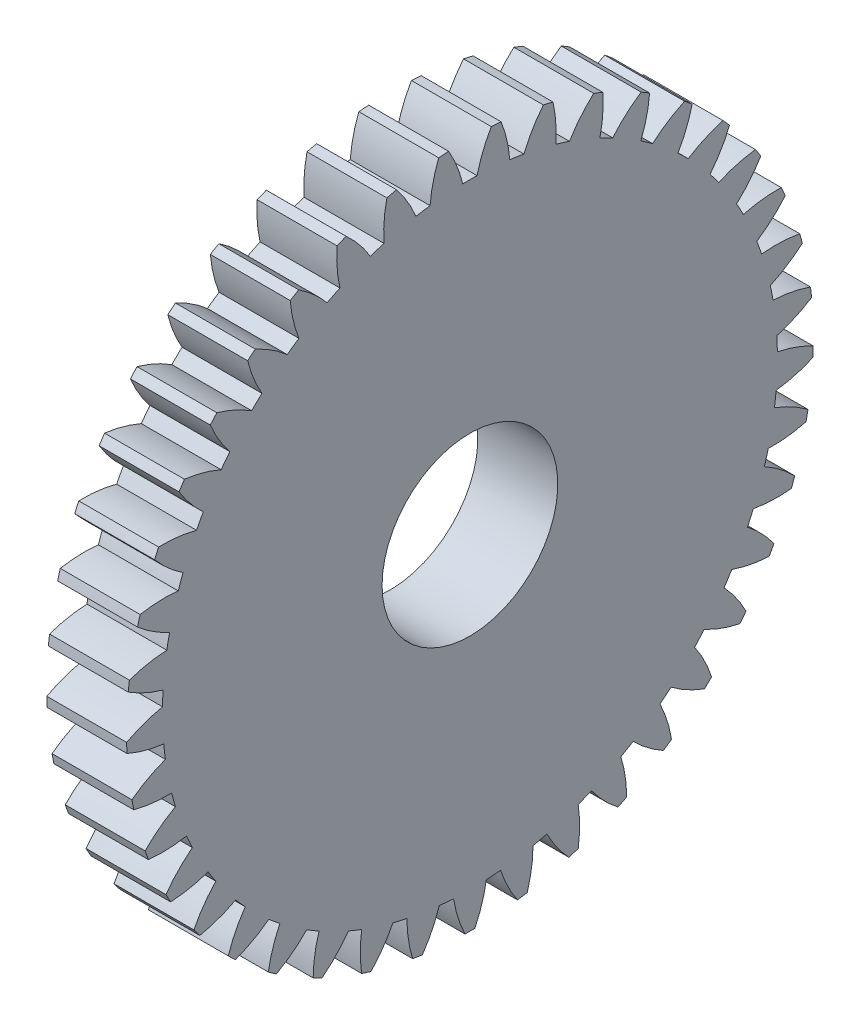
from build123d import *

# Parameters (mm, degrees)
SKETCH1_R           = 5.5
BOSS_EXTRUDE1_DEPTH = 2.5


with BuildPart() as part:
    # Sketch1 → Boss-Extrude1 (new, symmetric)
    with BuildSketch(Plane(origin=(0, 0, 0), x_dir=(0, 0, -1), z_dir=(1, 0, 0))):
        with BuildLine():
            ThreePointArc((-21.391404293, 2.158198868), (-20.337604136, 1.591457152), (-19.212545081, 1.184108323))
            ThreePointArc((-19.212545081, 1.184108323), (-19.234874719, 0.737289321), (-19.246814261, 0.290072057))
            ThreePointArc((-19.246814261, 0.290072057), (-20.399754417, -0.029959099), (-21.493846171, -0.514370267))
            ThreePointArc((-21.493846171, -0.514370267), (-21.484222893, -0.823508774), (-21.470153613, -1.132476862))
            ThreePointArc((-21.470153613, -1.132476862), (-20.342190829, -1.531714765), (-19.168135482, -1.762550179))
            ThreePointArc((-19.168135482, -1.762550179), (-19.121996826, -2.207541255), (-19.065529046, -2.651339885))
            ThreePointArc((-19.065529046, -2.651339885), (-20.156104706, -3.143615901), (-21.16342915, -3.789362299))
            ThreePointArc((-21.16342915, -3.789362299), (-21.10672888, -4.093408847), (-21.045660729, -4.396608295))
            ThreePointArc((-21.045660729, -4.396608295), (-19.86997381, -4.618984587), (-18.674441034, -4.667895999))
            ThreePointArc((-18.674441034, -4.667895999), (-18.560915534, -5.100628936), (-18.43736399, -5.530606667))
            ThreePointArc((-18.43736399, -5.530606667), (-19.440012983, -6.183589011), (-20.336959286, -6.97553489))
            ThreePointArc((-20.336959286, -6.97553489), (-20.234511032, -7.267362886), (-20.127875394, -7.557686955))
            ThreePointArc((-20.127875394, -7.557686955), (-18.932021447, -7.597989325), (-17.743033516, -7.463830293))
            ThreePointArc((-17.743033516, -7.463830293), (-17.564782114, -7.874162197), (-17.377042748, -8.280240717))
            ThreePointArc((-17.377042748, -8.280240717), (-18.268263833, -9.078624036), (-19.033808334, -9.998206855))
            ThreePointArc((-19.033808334, -9.998206855), (-18.888013395, -10.270976098), (-18.738309721, -10.541619838))
            ThreePointArc((-18.738309721, -10.541619838), (-17.550318547, -10.398903632), (-16.395744331, -10.084818731))
            ThreePointArc((-16.395744331, -10.084818731), (-16.156945088, -10.46313177), (-15.909418353, -10.835792942))
            ThreePointArc((-15.909418353, -10.835792942), (-16.668322062, -11.760863807), (-17.284521046, -12.786529326))
            ThreePointArc((-17.284521046, -12.786529326), (-17.098796732, -13.033846336), (-16.909533949, -13.278466087))
            ThreePointArc((-16.909533949, -13.278466087), (-15.757251055, -12.956076452), (-14.664152794, -12.469427566))
            ThreePointArc((-14.664152794, -12.469427566), (-14.370402963, -12.806854402), (-14.068890675, -13.137363365))
            ThreePointArc((-14.068890675, -13.137363365), (-14.677688949, -14.167438899), (-15.130099235, -15.275146387))
            ThreePointArc((-15.130099235, -15.275146387), (-14.908798767, -15.491214262), (-14.684413033, -15.704076346))
            ThreePointArc((-14.684413033, -15.704076346), (-13.594846953, -15.209569822), (-12.588845946, -14.561763587))
            ThreePointArc((-12.588845946, -14.561763587), (-12.247030772, -14.850395222), (-11.898600124, -15.131005125))
            ThreePointArc((-11.898600124, -15.131005125), (-12.343023247, -16.241941231), (-12.621040722, -17.405726963))
            ThreePointArc((-12.621040722, -17.405726963), (-12.369351195, -17.585481256), (-12.115101922, -17.761596365))
            ThreePointArc((-12.115101922, -17.761596365), (-11.113791161, -17.106563765), (-10.218467217, -16.312784211))
            ThreePointArc((-10.218467217, -16.312784211), (-9.836598561, -16.545855365), (-9.449416472, -16.769988949))
            ThreePointArc((-9.449416472, -16.769988949), (-9.719047542, -17.935746227), (-9.816155711, -19.128332051))
            ThreePointArc((-9.816155711, -19.128332051), (-9.539976514, -19.267559475), (-9.26182309, -19.402799619))
            ThreePointArc((-9.26182309, -19.402799619), (-8.372237525, -18.602594353), (-7.608576279, -17.681447))
            ThreePointArc((-7.608576279, -17.681447), (-7.195604816, -17.853494681), (-6.778746506, -18.015898446))
            ThreePointArc((-6.778746506, -18.015898446), (-6.8672656, -19.209152532), (-6.78118833, -20.402585249))
            ThreePointArc((-6.78118833, -20.402585249), (-6.48699287, -20.498022429), (-6.191454975, -20.589217695))
            ThreePointArc((-6.191454975, -20.589217695), (-5.434445736, -19.662595896), (-4.82034676, -18.635671657))
            ThreePointArc((-4.82034676, -18.635671657), (-4.385952193, -18.742663214), (-3.949188467, -18.839530553))
            ThreePointArc((-3.949188467, -18.839530553), (-3.854520773, -20.032312584), (-3.587275642, -21.198619141))
            ThreePointArc((-3.587275642, -21.198619141), (-3.281959611, -21.248029111), (-2.975964402, -21.293041959))
            ThreePointArc((-2.975964402, -21.293041959), (-2.369275146, -20.261722857), (-1.9191324, -19.153091965))
            ThreePointArc((-1.9191324, -19.153091965), (-1.473496568, -19.192519607), (-1.027064798, -19.221580031))
            ThreePointArc((-1.027064798, -19.221580031), (-0.751429246, -20.385932206), (-0.309280253, -21.497775367))
            ThreePointArc((-0.309280253, -21.497775367), (0, -21.5), (0.309280253, -21.497775367))
            ThreePointArc((0.309280253, -21.497775367), (0.751429246, -20.385932206), (1.027064798, -19.221580031))
            ThreePointArc((1.027064798, -19.221580031), (1.473496568, -19.192519607), (1.9191324, -19.153091965))
            ThreePointArc((1.9191324, -19.153091965), (2.369275146, -20.261722857), (2.975964402, -21.293041959))
            ThreePointArc((2.975964402, -21.293041959), (3.281959611, -21.248029111), (3.587275642, -21.198619141))
            ThreePointArc((3.587275642, -21.198619141), (3.854520773, -20.032312584), (3.949188467, -18.839530553))
            ThreePointArc((3.949188467, -18.839530553), (4.385952193, -18.742663214), (4.82034676, -18.635671657))
            ThreePointArc((4.82034676, -18.635671657), (5.434445736, -19.662595896), (6.191454975, -20.589217695))
            ThreePointArc((6.191454975, -20.589217695), (6.48699287, -20.498022429), (6.78118833, -20.402585249))
            ThreePointArc((6.78118833, -20.402585249), (6.8672656, -19.209152532), (6.778746506, -18.015898446))
            ThreePointArc((6.778746506, -18.015898446), (7.195604816, -17.853494681), (7.608576279, -17.681447))
            ThreePointArc((7.608576279, -17.681447), (8.372237525, -18.602594353), (9.26182309, -19.402799619))
            ThreePointArc((9.26182309, -19.402799619), (9.539976514, -19.267559475), (9.816155711, -19.128332051))
            ThreePointArc((9.816155711, -19.128332051), (9.719047542, -17.935746227), (9.449416472, -16.769988949))
            ThreePointArc((9.449416472, -16.769988949), (9.836598561, -16.545855365), (10.218467217, -16.312784211))
            ThreePointArc((10.218467217, -16.312784211), (11.113791161, -17.106563765), (12.115101922, -17.761596365))
            ThreePointArc((12.115101922, -17.761596365), (12.369351195, -17.585481256), (12.621040722, -17.405726963))
            ThreePointArc((12.621040722, -17.405726963), (12.343023247, -16.241941231), (11.898600124, -15.131005125))
            ThreePointArc((11.898600124, -15.131005125), (12.247030772, -14.850395222), (12.588845946, -14.561763587))
            ThreePointArc((12.588845946, -14.561763587), (13.594846953, -15.209569822), (14.684413033, -15.704076346))
            ThreePointArc((14.684413033, -15.704076346), (14.908798767, -15.491214262), (15.130099235, -15.275146387))
            ThreePointArc((15.130099235, -15.275146387), (14.677688949, -14.167438899), (14.068890675, -13.137363365))
            ThreePointArc((14.068890675, -13.137363365), (14.370402963, -12.806854402), (14.664152794, -12.469427566))
            ThreePointArc((14.664152794, -12.469427566), (15.757251055, -12.956076452), (16.909533949, -13.278466087))
            ThreePointArc((16.909533949, -13.278466087), (17.098796732, -13.033846336), (17.284521046, -12.786529326))
            ThreePointArc((17.284521046, -12.786529326), (16.668322062, -11.760863807), (15.909418353, -10.835792942))
            ThreePointArc((15.909418353, -10.835792942), (16.156945088, -10.46313177), (16.395744331, -10.084818731))
            ThreePointArc((16.395744331, -10.084818731), (17.550318547, -10.398903632), (18.738309721, -10.541619838))
            ThreePointArc((18.738309721, -10.541619838), (18.888013395, -10.270976098), (19.033808334, -9.998206855))
            ThreePointArc((19.033808334, -9.998206855), (18.268263833, -9.078624036), (17.377042748, -8.280240717))
            ThreePointArc((17.377042748, -8.280240717), (17.564782114, -7.874162197), (17.743033516, -7.463830293))
            ThreePointArc((17.743033516, -7.463830293), (18.932021447, -7.597989325), (20.127875394, -7.557686955))
            ThreePointArc((20.127875394, -7.557686955), (20.234511032, -7.267362886), (20.336959286, -6.97553489))
            ThreePointArc((20.336959286, -6.97553489), (19.440012983, -6.183589011), (18.43736399, -5.530606667))
            ThreePointArc((18.43736399, -5.530606667), (18.560915534, -5.100628936), (18.674441034, -4.667895999))
            ThreePointArc((18.674441034, -4.667895999), (19.86997381, -4.618984587), (21.045660729, -4.396608295))
            ThreePointArc((21.045660729, -4.396608295), (21.10672888, -4.093408847), (21.16342915, -3.789362299))
            ThreePointArc((21.16342915, -3.789362299), (20.156104706, -3.143615901), (19.065529046, -2.651339885))
            ThreePointArc((19.065529046, -2.651339885), (19.121996826, -2.207541255), (19.168135482, -1.762550179))
            ThreePointArc((19.168135482, -1.762550179), (20.342190829, -1.531714765), (21.470153613, -1.132476862))
            ThreePointArc((21.470153613, -1.132476862), (21.484222893, -0.823508774), (21.493846171, -0.514370267))
            ThreePointArc((21.493846171, -0.514370267), (20.399754417, -0.029959099), (19.246814261, 0.290072057))
            ThreePointArc((19.246814261, 0.290072057), (19.234874719, 0.737289321), (19.212545081, 1.184108323))
            ThreePointArc((19.212545081, 1.184108323), (20.337604136, 1.591457152), (21.391404293, 2.158198868))
            ThreePointArc((21.391404293, 2.158198868), (21.35814493, 2.465693646), (21.320465656, 2.772678167))
            ThreePointArc((21.320465656, 2.772678167), (20.165251176, 3.084399919), (18.976970463, 3.224684956))
            ThreePointArc((18.976970463, 3.224684956), (18.896903452, 3.66483846), (18.806628906, 4.10301233))
            ThreePointArc((18.806628906, 4.10301233), (19.856321239, 4.677326663), (20.811258588, 5.398288245))
            ThreePointArc((20.811258588, 5.398288245), (20.731450152, 5.697102297), (20.647351496, 5.994737376))
            ThreePointArc((20.647351496, 5.994737376), (19.458091538, 6.126463217), (18.26232256, 6.083713973))
            ThreePointArc((18.26232256, 6.083713973), (18.116004784, 6.506486892), (17.95990129, 6.925745205))
            ThreePointArc((17.95990129, 6.925745205), (18.909623001, 7.653563601), (19.74331462, 8.511846322))
            ThreePointArc((19.74331462, 8.511846322), (19.618827754, 8.794975699), (19.490280917, 9.076285021))
            ThreePointArc((19.490280917, 9.076285021), (18.294850726, 9.02492741), (17.119621296, 8.80014589))
            ThreePointArc((17.119621296, 8.80014589), (16.910482318, 9.195628787), (16.69220881, 9.586144483))
            ThreePointArc((16.69220881, 9.586144483), (17.519699228, 10.450407495), (18.212604091, 11.425893935))
            ThreePointArc((18.212604091, 11.425893935), (18.046356662, 11.686702325), (17.876374672, 11.945092238))
            ThreePointArc((17.876374672, 11.945092238), (16.702794119, 11.711854953), (15.575650618, 11.310309846))
            ThreePointArc((15.575650618, 11.310309846), (15.308592479, 11.669232936), (15.033265103, 12.021852659))
            ThreePointArc((15.033265103, 12.021852659), (15.719128554, 13.002302694), (16.255005559, 14.072128279))
            ThreePointArc((16.255005559, 14.072128279), (16.050894265, 14.304502554), (15.843461357, 14.533916617))
            ThreePointArc((15.843461357, 14.533916617), (14.719238175, 14.124266543), (13.666599891, 13.555369726))
            ThreePointArc((13.666599891, 13.555369726), (13.347882208, 13.869320155), (13.021954403, 14.175778798))
            ThreePointArc((13.021954403, 14.175778798), (13.550114829, 15.249434939), (13.916403473, 16.388523862))
            ThreePointArc((13.916403473, 16.388523862), (13.67921251, 16.587017366), (13.439190735, 16.782078309))
            ThreePointArc((13.439190735, 16.782078309), (12.390675763, 16.205617297), (11.437215646, 15.482703229))
            ThreePointArc((11.437215646, 15.482703229), (11.074308891, 15.744322265), (10.705420129, 15.997436697))
            ThreePointArc((10.705420129, 15.997436697), (11.063497897, 17.139133354), (11.251612685, 18.320786337))
            ThreePointArc((11.251612685, 18.320786337), (10.986901608, 18.48074655), (10.719916873, 18.63688231))
            ThreePointArc((10.719916873, 18.63688231), (9.771686414, 17.907122116), (8.93975276, 17.04713529))
            ThreePointArc((8.93975276, 17.04713529), (8.541163159, 17.250290806), (8.137959881, 17.444128238))
            ThreePointArc((8.137959881, 17.444128238), (8.317561952, 18.627105009), (8.323093632, 19.823625107))
            ThreePointArc((8.323093632, 19.823625107), (8.037067045, 19.941302699), (7.749377246, 20.054853585))
            ThreePointArc((7.749377246, 20.054853585), (6.923657017, 19.18889917), (6.232749646, 18.211996948))
            ThreePointArc((6.232749646, 18.211996948), (5.807819802, 18.351927151), (5.37975275, 18.481944198))
            ThreePointArc((5.37975275, 18.481944198), (5.376669404, 19.678473111), (5.199488318, 20.861814907))
            ThreePointArc((5.199488318, 20.861814907), (4.898850441, 20.934451613), (4.597198784, 21.002756089))
            ThreePointArc((4.597198784, 21.002756089), (3.913342967, 20.020904691), (3.379656163, 18.949984834))
            ThreePointArc((3.379656163, 18.949984834), (2.938346072, 19.023409877), (2.495448775, 19.086559051))
            ThreePointArc((2.495448775, 19.086559051), (2.309752282, 20.268594481), (1.954011405, 21.411021448))
            ThreePointArc((1.954011405, 21.411021448), (1.645808936, 21.436914725), (1.337265878, 21.458371792))
            ThreePointArc((1.337265878, 21.458371792), (0.811303476, 20.383637176), (0.447346404, 19.243801137))
            ThreePointArc((0.447346404, 19.243801137), (0, 19.249), (-0.447346404, 19.243801137))
            ThreePointArc((-0.447346404, 19.243801137), (-0.811303476, 20.383637176), (-1.337265878, 21.458371792))
            ThreePointArc((-1.337265878, 21.458371792), (-1.645808936, 21.436914725), (-1.954011405, 21.411021448))
            ThreePointArc((-1.954011405, 21.411021448), (-2.309752282, 20.268594481), (-2.495448775, 19.086559051))
            ThreePointArc((-2.495448775, 19.086559051), (-2.938346072, 19.023409877), (-3.379656163, 18.949984834))
            ThreePointArc((-3.379656163, 18.949984834), (-3.913342967, 20.020904691), (-4.597198784, 21.002756089))
            ThreePointArc((-4.597198784, 21.002756089), (-4.898850441, 20.934451613), (-5.199488318, 20.861814907))
            ThreePointArc((-5.199488318, 20.861814907), (-5.376669404, 19.678473111), (-5.37975275, 18.481944198))
            ThreePointArc((-5.37975275, 18.481944198), (-5.807819802, 18.351927151), (-6.232749646, 18.211996948))
            ThreePointArc((-6.232749646, 18.211996948), (-6.923657017, 19.18889917), (-7.749377246, 20.054853585))
            ThreePointArc((-7.749377246, 20.054853585), (-8.037067045, 19.941302699), (-8.323093632, 19.823625107))
            ThreePointArc((-8.323093632, 19.823625107), (-8.317561952, 18.627105009), (-8.137959881, 17.444128238))
            ThreePointArc((-8.137959881, 17.444128238), (-8.541163159, 17.250290806), (-8.93975276, 17.04713529))
            ThreePointArc((-8.93975276, 17.04713529), (-9.771686414, 17.907122116), (-10.719916873, 18.63688231))
            ThreePointArc((-10.719916873, 18.63688231), (-10.986901608, 18.48074655), (-11.251612685, 18.320786337))
            ThreePointArc((-11.251612685, 18.320786337), (-11.063497897, 17.139133354), (-10.705420129, 15.997436697))
            ThreePointArc((-10.705420129, 15.997436697), (-11.074308891, 15.744322265), (-11.437215646, 15.482703229))
            ThreePointArc((-11.437215646, 15.482703229), (-12.390675763, 16.205617297), (-13.439190735, 16.782078309))
            ThreePointArc((-13.439190735, 16.782078309), (-13.67921251, 16.587017366), (-13.916403473, 16.388523862))
            ThreePointArc((-13.916403473, 16.388523862), (-13.550114829, 15.249434939), (-13.021954403, 14.175778798))
            ThreePointArc((-13.021954403, 14.175778798), (-13.347882208, 13.869320155), (-13.666599891, 13.555369726))
            ThreePointArc((-13.666599891, 13.555369726), (-14.719238175, 14.124266543), (-15.843461357, 14.533916617))
            ThreePointArc((-15.843461357, 14.533916617), (-16.050894265, 14.304502554), (-16.255005559, 14.072128279))
            ThreePointArc((-16.255005559, 14.072128279), (-15.719128554, 13.002302694), (-15.033265103, 12.021852659))
            ThreePointArc((-15.033265103, 12.021852659), (-15.308592479, 11.669232936), (-15.575650618, 11.310309846))
            ThreePointArc((-15.575650618, 11.310309846), (-16.702794119, 11.711854953), (-17.876374672, 11.945092238))
            ThreePointArc((-17.876374672, 11.945092238), (-18.046356662, 11.686702325), (-18.212604091, 11.425893935))
            ThreePointArc((-18.212604091, 11.425893935), (-17.519699228, 10.450407495), (-16.69220881, 9.586144483))
            ThreePointArc((-16.69220881, 9.586144483), (-16.910482318, 9.195628787), (-17.119621296, 8.80014589))
            ThreePointArc((-17.119621296, 8.80014589), (-18.294850726, 9.02492741), (-19.490280917, 9.076285021))
            ThreePointArc((-19.490280917, 9.076285021), (-19.618827754, 8.794975699), (-19.74331462, 8.511846322))
            ThreePointArc((-19.74331462, 8.511846322), (-18.909623001, 7.653563601), (-17.95990129, 6.925745205))
            ThreePointArc((-17.95990129, 6.925745205), (-18.116004784, 6.506486892), (-18.26232256, 6.083713973))
            ThreePointArc((-18.26232256, 6.083713973), (-19.458091538, 6.126463217), (-20.647351496, 5.994737376))
            ThreePointArc((-20.647351496, 5.994737376), (-20.731450152, 5.697102297), (-20.811258588, 5.398288245))
            ThreePointArc((-20.811258588, 5.398288245), (-19.856321239, 4.677326663), (-18.806628906, 4.10301233))
            ThreePointArc((-18.806628906, 4.10301233), (-18.896903452, 3.66483846), (-18.976970463, 3.224684956))
            ThreePointArc((-18.976970463, 3.224684956), (-20.165251176, 3.084399919), (-21.320465656, 2.772678167))
            ThreePointArc((-21.320465656, 2.772678167), (-21.35814493, 2.465693646), (-21.391404293, 2.158198868))
        make_face()
        with Locations(Location((0, 0, 0), (0, 0, 180))):
            Circle(SKETCH1_R, mode=Mode.SUBTRACT)
    extrude(amount=BOSS_EXTRUDE1_DEPTH, both=True)


solid = part.part
